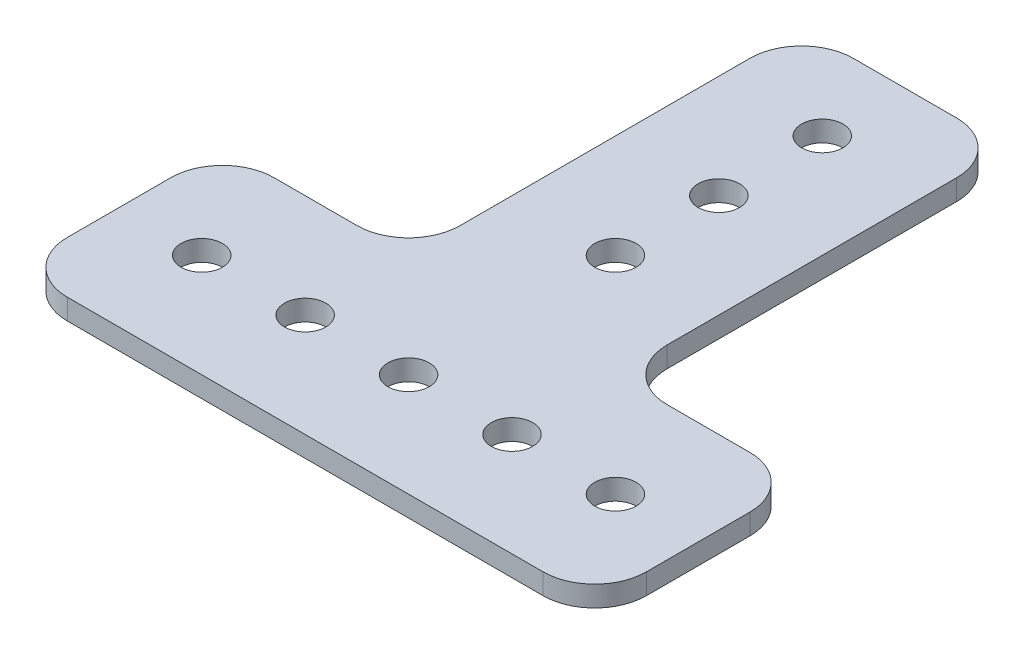
from build123d import *

# Parameters (mm, degrees)
EXTRUDE_1_DEPTH       = 2
HOLE_WIZARD_4_0_4_1_D = 4
FILLET_1_R            = 5
FILLET_2_R            = 5
HOLE_WIZARD_4_0_4_2_D = 4


with BuildPart() as part:
    # 草圖1 → 填料-伸長1 (new body)
    with BuildSketch(Plane(origin=(0, 0, 0), x_dir=(1, 0, 0), z_dir=(0, 1, 0))):
        Polygon((0, 0), (18, 0), (18, 38), (38, 38), (38, 0), (56, 0), (56, -20), (0, -20), align=None)
    extrude(amount=EXTRUDE_1_DEPTH)

    # Ø4.0 (4) 直徑孔1 (through all)
    with Locations(Plane(origin=(0, 0, 0), x_dir=(-1, 0, 0), z_dir=(0, -1, 0))):
        with Locations((-28, 30), (-28, 10), (-28, -10), (-8, -10), (-48, -10)):
            Hole(HOLE_WIZARD_4_0_4_1_D / 2)

    # 圓角1
    fillet_1_edges = [part.edges().sort_by_distance(p)[0] for p in [
        (0, 1, 0),
        (18, 1, -38),
        (38, 1, -38),
        (56, 1, 0),
        (56, 1, 20),
        (0, 1, 20),
    ]]
    fillet(fillet_1_edges, radius=FILLET_1_R)

    # 圓角2
    fillet_2_edges = [part.edges().sort_by_distance(p)[0] for p in [
        (18, 1, 0),
        (38, 1, 0),
    ]]
    fillet(fillet_2_edges, radius=FILLET_2_R)

    # Ø4.0 (4) 直徑孔2 (through all)
    with Locations(Plane(origin=(0, 0, 0), x_dir=(-1, 0, 0), z_dir=(0, -1, 0))):
        with Locations((-38, -10), (-18, -10), (-28, 20)):
            Hole(HOLE_WIZARD_4_0_4_2_D / 2)


solid = part.part
